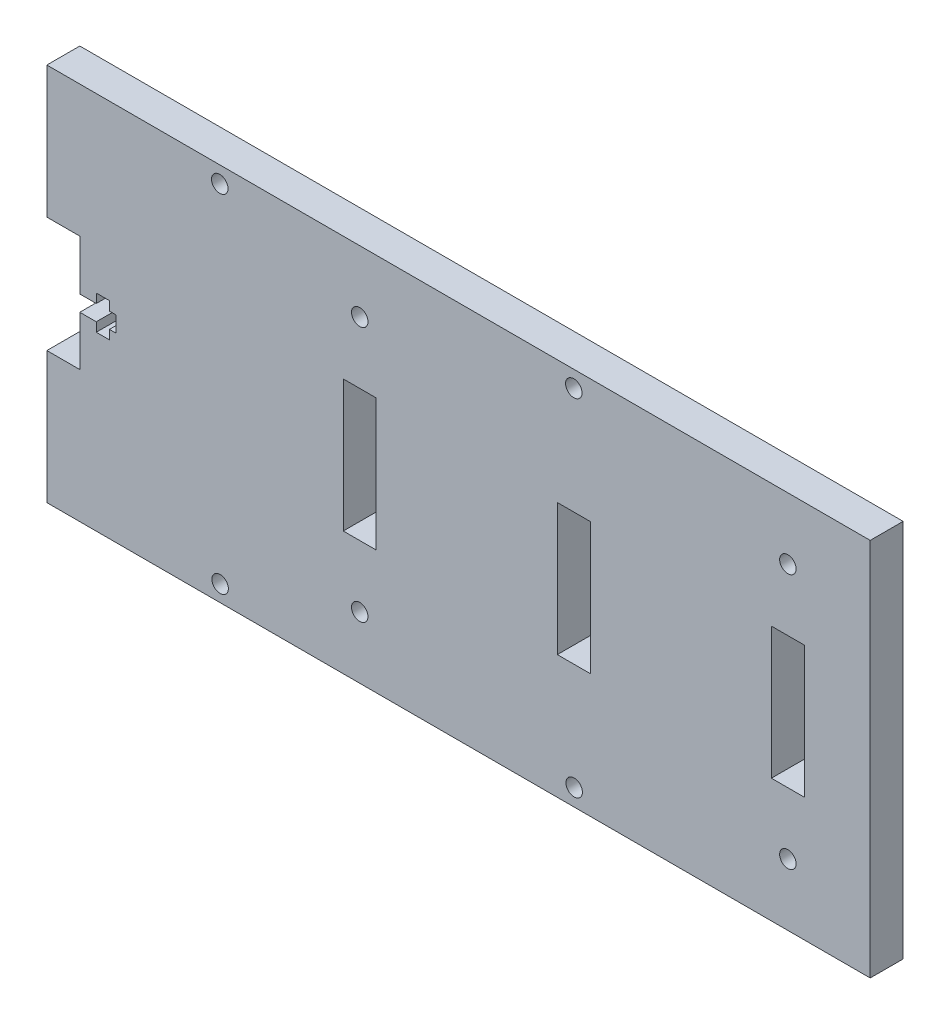
from build123d import *

# Parameters (mm, degrees)
SKETCH1_R           = 1.5875
SKETCH1_W           = 6.35
SKETCH1_H           = 25.4
BOSS_EXTRUDE1_DEPTH = 6.35


with BuildPart() as part:
    # Sketch1 → Boss-Extrude1 (new body)
    with BuildSketch(Plane.XY):
        Polygon((-80.70648923, -31.56367818), (-80.70648923, -21.997051347), (-77.53148923, -21.997051347), (-77.53148923, -23.749651347), (-74.99148923, -23.749651347), (-74.99148923, -21.997051347), (-73.72148923, -21.997051347), (-73.72148923, -18.949191991), (-74.99148923, -18.949191991), (-74.99148923, -17.196591991), (-77.53148923, -17.196591991), (-77.53148923, -18.949191991), (-80.70648923, -18.949191991), (-80.70648923, -9.28787818), (-87.05648923, -9.28787818), (-87.05648923, 16.11212182), (-80.70648923, 16.11212182), (71.69351077, 16.11212182), (71.69351077, -56.96367818), (-80.70648923, -56.96367818), (-87.05648923, -56.96367818), (-87.05648923, -31.56367818), align=None)
        with Locations((-26.73148923, 4.19317182)):
            Circle(SKETCH1_R, mode=Mode.SUBTRACT)
        with Locations((-26.73148923, -45.04472818)):
            Circle(SKETCH1_R, mode=Mode.SUBTRACT)
        with Locations((55.81851077, 4.19317182)):
            Circle(SKETCH1_R, mode=Mode.SUBTRACT)
        with Locations((55.81851077, -45.04472818)):
            Circle(SKETCH1_R, mode=Mode.SUBTRACT)
        with Locations((-53.71898923, 12.93712182)):
            Circle(SKETCH1_R, mode=Mode.SUBTRACT)
        with Locations((14.54351077, 12.93712182)):
            Circle(SKETCH1_R, mode=Mode.SUBTRACT)
        with Locations((-53.64679782, -53.840086503)):
            Circle(SKETCH1_R, mode=Mode.SUBTRACT)
        with Locations((14.615542619, -53.692492422)):
            Circle(SKETCH1_R, mode=Mode.SUBTRACT)
        with Locations((-26.73148923, -20.42577818)):
            Rectangle(SKETCH1_W, SKETCH1_H, mode=Mode.SUBTRACT)
        with Locations((55.81851077, -20.42577818)):
            Rectangle(SKETCH1_W, SKETCH1_H, mode=Mode.SUBTRACT)
        with Locations((14.54351077, -20.42577818)):
            Rectangle(SKETCH1_W, SKETCH1_H, mode=Mode.SUBTRACT)
    extrude(amount=BOSS_EXTRUDE1_DEPTH)


solid = part.part
